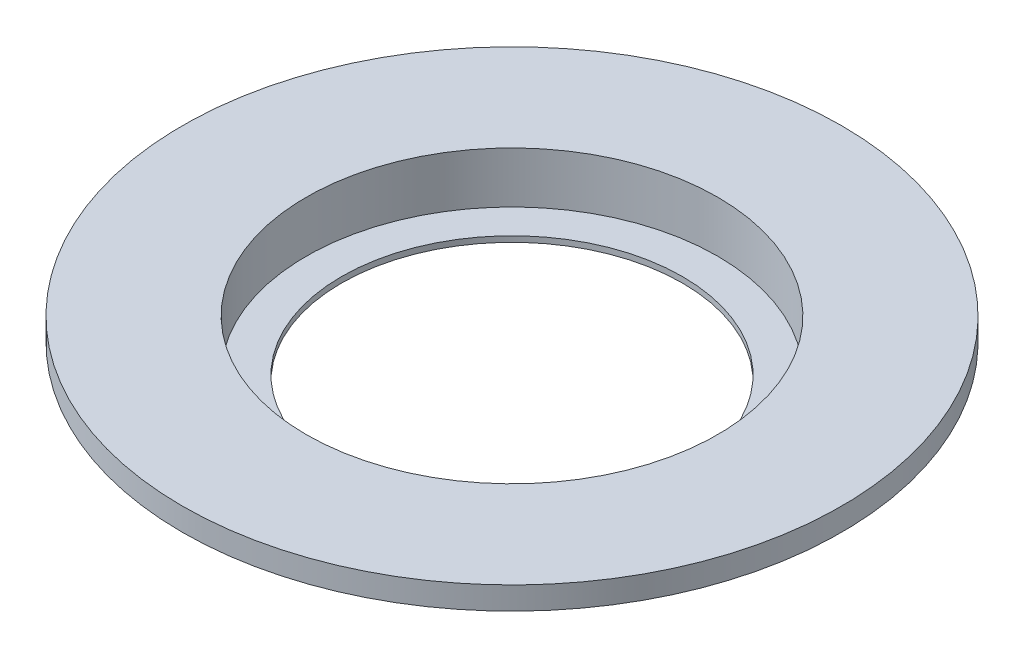
from build123d import *

# Parameters (mm, degrees)
SKETCH3_R           = 37.2
BOSS_EXTRUDE1_DEPTH = 10
SKETCH4_R           = 36.2
CUT_EXTRUDE1_DEPTH  = 9
SKETCH5_R           = 30
CUT_EXTRUDE2_DEPTH  = 9
SKETCH6_R           = 58
SKETCH6_R_2         = 37.2
BOSS_EXTRUDE2_DEPTH = 4
SKETCH7_R           = 47.8
SKETCH7_R_2         = 46.5
BOSS_EXTRUDE3_DEPTH = 3


with BuildPart() as part:
    # Sketch3 → Boss-Extrude1 (new body)
    with BuildSketch(Plane(origin=(0, 0, 0), x_dir=(1, 0, 0), z_dir=(0, 1, 0))):
        with Locations(Location((0, 0, 0), (0, 0, 270))):
            Circle(SKETCH3_R)
    extrude(amount=BOSS_EXTRUDE1_DEPTH)

    # Sketch4 → Cut-Extrude1 (cut)
    with BuildSketch(Plane(origin=(0, 10, 0), x_dir=(1, 0, 0), z_dir=(0, 1, 0))):
        with Locations(Location((0, 0, 0), (0, 0, 270))):
            Circle(SKETCH4_R)
    extrude(amount=-CUT_EXTRUDE1_DEPTH, mode=Mode.SUBTRACT)

    # Sketch5 → Cut-Extrude2 (cut)
    with BuildSketch(Plane(origin=(0, 1, 0), x_dir=(1, 0, 0), z_dir=(0, 1, 0))):
        with Locations(Location((0, 0, 0), (0, 0, 270))):
            Circle(SKETCH5_R)
    extrude(amount=-CUT_EXTRUDE2_DEPTH, mode=Mode.SUBTRACT)

    # Sketch6 → Boss-Extrude2 (add)
    with BuildSketch(Plane(origin=(0, 6, 0), x_dir=(1, 0, 0), z_dir=(0, 1, 0))):
        with Locations(Location((0, 0, 0), (0, 0, 270))):
            Circle(SKETCH6_R)
        with Locations(Location((0, 0, 0), (0, 0, 270))):
            Circle(SKETCH6_R_2, mode=Mode.SUBTRACT)
    extrude(amount=BOSS_EXTRUDE2_DEPTH)

    # Sketch7 → Boss-Extrude3 (add)
    with BuildSketch(Plane.XZ.offset(-6)):
        with Locations(Location((0, 0, 0), (0, 0, 90))):
            Circle(SKETCH7_R)
        with Locations(Location((0, 0, 0), (0, 0, 270))):
            Circle(SKETCH7_R_2, mode=Mode.SUBTRACT)
    extrude(amount=BOSS_EXTRUDE3_DEPTH)


solid = part.part
